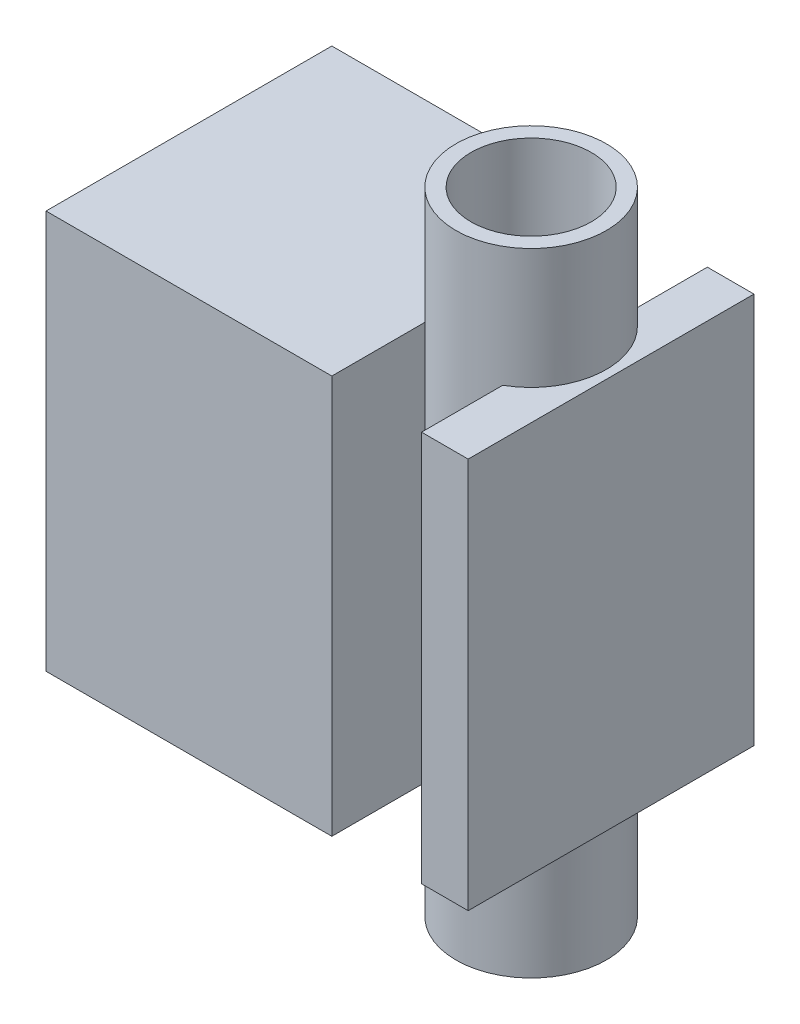
from build123d import *

# Parameters (mm, degrees)
BOSS_EXTRUDE1_DEPTH     = 38
SKETCH3_R               = 10
BOSS_EXTRUDE4_DEPTH     = 84
CUT_EXTRUDE1_DEPTH      = 142.830361505
CUT_EXTRUDE1_DEPTH_BACK = 142.830361505
SKETCH4_R               = 8
CUT_EXTRUDE2_DEPTH      = 142.830361505
CUT_EXTRUDE2_DEPTH_BACK = 142.830361505
BOSS_EXTRUDE5_START     = -16
BOSS_EXTRUDE5_DEPTH     = 52


with BuildPart() as part:
    # Sketch2 → Boss-Extrude1 (new body)
    with BuildSketch(Plane.XY):
        Polygon((-107.776859504, 29.566115702), (-69.776859504, 29.566115702), (-69.776859504, 45.066115702), (-49.776859504, 45.066115702), (-49.776859504, -38.933884298), (-69.776859504, -38.933884298), (-69.776859504, -23.433884298), (-107.776859504, -23.433884298), align=None)
    extrude(amount=BOSS_EXTRUDE1_DEPTH)

    # Sketch3 → Boss-Extrude4 (add)
    with BuildSketch(Plane(origin=(0, 45.066115702, 0), x_dir=(1, 0, 0), z_dir=(0, 1, 0))):
        with Locations((-62.776859504, -18.5)):
            Circle(SKETCH3_R)
    extrude(amount=-BOSS_EXTRUDE4_DEPTH)

    # Sketch4 → Cut-Extrude1 (cut, two sides: drawn at the far end of the back side and taken through both)
    with BuildSketch(Plane(origin=(0, 45.066115702, 0), x_dir=(1, 0, 0), z_dir=(0, 1, 0)).offset(-CUT_EXTRUDE1_DEPTH_BACK)):
        with Locations(Location((-62.776859504, -18.5, 0), (0, 0, 270))):
            Circle(SKETCH4_R)
    extrude(amount=CUT_EXTRUDE1_DEPTH + CUT_EXTRUDE1_DEPTH_BACK, mode=Mode.SUBTRACT)

    # Sketch5 → Cut-Extrude2 (cut, two sides: drawn at the far end of the back side and taken through both)
    with BuildSketch(Plane(origin=(0, 45.066115702, 0), x_dir=(1, 0, 0), z_dir=(0, 1, 0)).offset(-CUT_EXTRUDE2_DEPTH_BACK)):
        with BuildLine():
            Line((-56.443650173, 0), (-69.776859504, 0))
            Line((-69.776859504, 0), (-69.776859504, -11.358571571))
            ThreePointArc((-69.776859504, -11.358571571), (-52.776859504, -18.5), (-69.776859504, -25.641428429))
            Line((-69.776859504, -25.641428429), (-69.776859504, -38))
            Line((-69.776859504, -38), (-56.443650173, -38))
            Line((-56.443650173, -38), (-49.776859504, -38))
            Line((-49.776859504, -38), (-49.776859504, 0))
            Line((-49.776859504, 0), (-56.443650173, 0))
        make_face()
    extrude(amount=CUT_EXTRUDE2_DEPTH + CUT_EXTRUDE2_DEPTH_BACK, mode=Mode.SUBTRACT)

    # Sketch6 → Boss-Extrude5 (add)
    with BuildSketch(Plane(origin=(0, 45.066115702, 0), x_dir=(1, 0, 0), z_dir=(0, 1, 0)).offset(BOSS_EXTRUDE5_START)):
        with BuildLine():
            Line((-57.850011392, 0), (-52.785705753, 0))
            Line((-52.785705753, 0), (-51.650992669, 0))
            Line((-51.650992669, 0), (-51.650992669, -38))
            Line((-51.650992669, -38), (-52.785705753, -38))
            Line((-52.785705753, -38), (-57.850011392, -38))
            Line((-57.850011392, -38), (-57.850011392, -24.802869797))
            ThreePointArc((-57.850011392, -24.802869797), (-54.776859504, -18.5), (-57.850011392, -12.197130203))
            Line((-57.850011392, -12.197130203), (-57.850011392, 0))
        make_face()
    extrude(amount=-BOSS_EXTRUDE5_DEPTH)


solid = part.part
